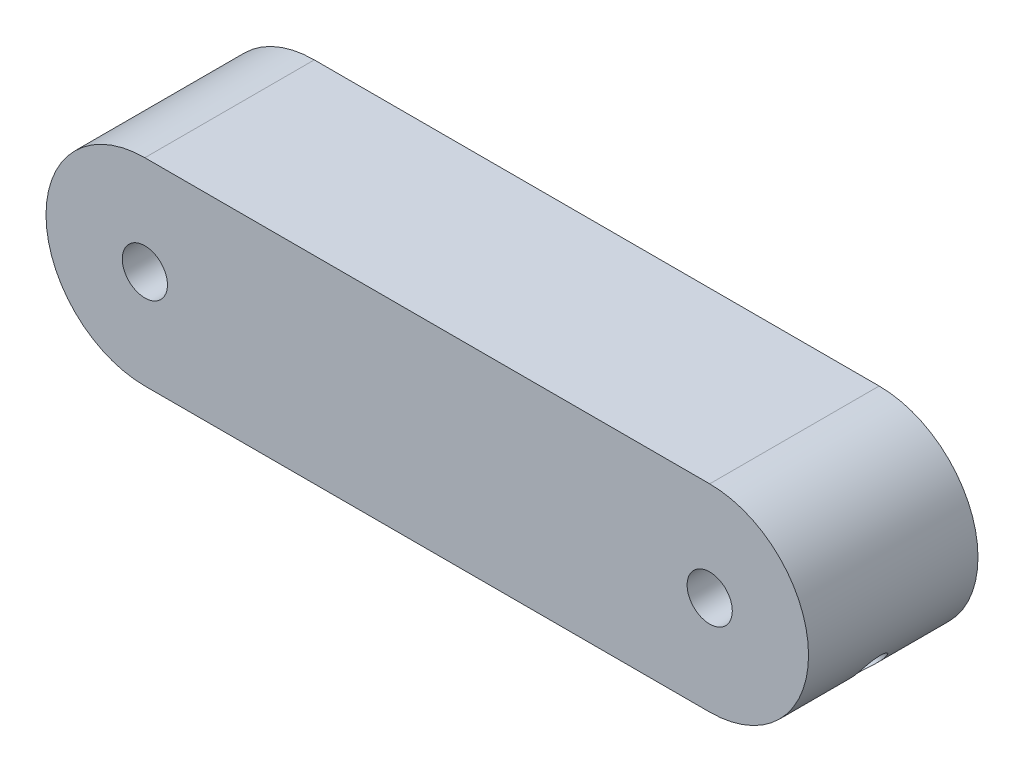
from build123d import *

# Parameters (mm, degrees)
BOSS_EXTRUDE1_DEPTH = 6
SKETCH2_R           = 1.6
CUT_EXTRUDE1_DEPTH  = 50.010203019
SKETCH3_R           = 1
CUT_EXTRUDE2_DEPTH  = 60


with BuildPart() as part:
    # Sketch1 → Boss-Extrude1 (new, symmetric)
    with BuildSketch(Plane.XY):
        with BuildLine():
            Line((0, 7), (40, 7))
            ThreePointArc((40, 7), (47, 0), (40, -7))
            Line((40, -7), (0, -7))
            ThreePointArc((0, -7), (-7, 0), (0, 7))
        make_face()
    extrude(amount=BOSS_EXTRUDE1_DEPTH, both=True)

    # Sketch2 → Cut-Extrude1 (cut, through all)
    with BuildSketch(Plane.XY.offset(6)):
        Circle(SKETCH2_R)
        with Locations((40, 0)):
            Circle(SKETCH2_R)
    extrude(amount=-CUT_EXTRUDE1_DEPTH, mode=Mode.SUBTRACT)

    # Sketch3 → Cut-Extrude2 (cut, symmetric)
    with BuildSketch(Plane(origin=(0, 0, 0), x_dir=(0, 0, -1), z_dir=(1, 0, 0))):
        with Locations((0, -4.5)):
            Circle(SKETCH3_R)
    extrude(amount=CUT_EXTRUDE2_DEPTH, both=True, mode=Mode.SUBTRACT)


solid = part.part
